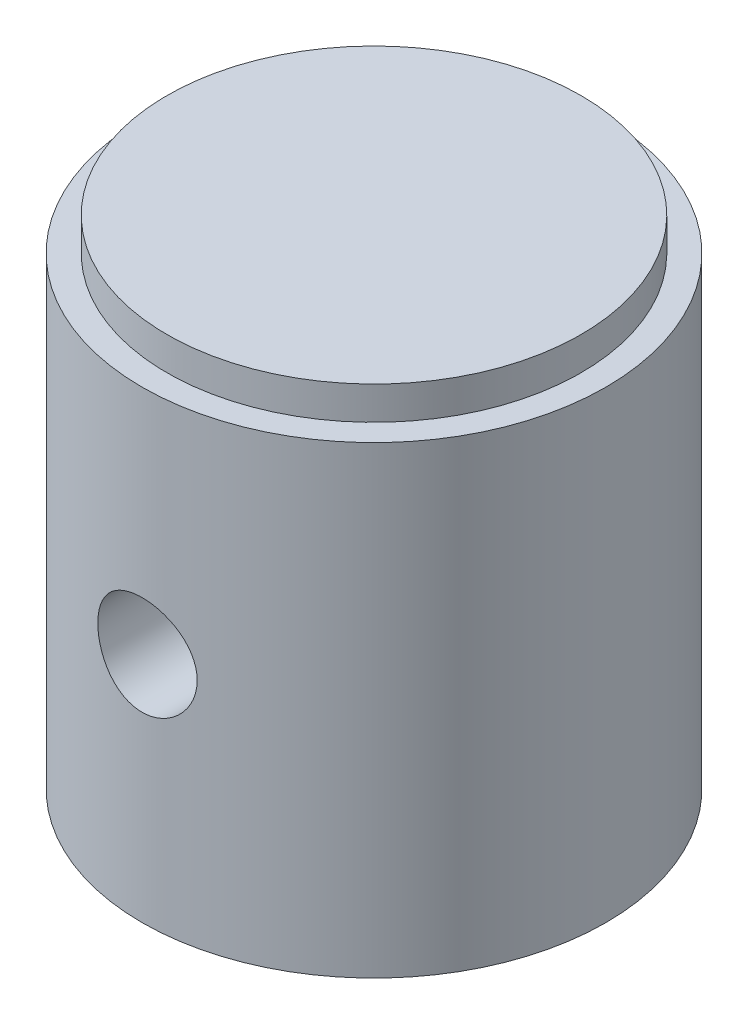
from build123d import *

# Parameters (mm, degrees)
CUT_EXTRUDE1_DEPTH      = 14.868123463
CUT_EXTRUDE1_DEPTH_BACK = 14.868123463
SKETCH2_R               = 1.5
SCALE1_SCALE            = 1.5


with BuildPart() as part:
    # Sketch1 → Revolve1 (revolve)
    with BuildSketch(Plane.XY, mode=Mode.PRIVATE) as revolve1_sk:
        Polygon((0, 9.712098042), (-6.25, 9.712098042), (-6.25, 8.712098042), (-7, 8.712098042), (-7, -5.287901958), (-6.25, -5.287901958), (-4.75, -1.166685828), (-4.75, 5.712098042), (0, 8.566185983), align=None)
    revolve(revolve1_sk.sketch.rotate(Axis((0, 2.420801252, 0), (0, 1, 0)), 270), axis=Axis((0, 2.420801252, 0), (0, 1, 0)))

    # Sketch2 → Cut-Extrude1 (cut, two sides: drawn at the far end of the back side and taken through both)
    with BuildSketch(Plane.XY.offset(-CUT_EXTRUDE1_DEPTH_BACK)):
        with Locations((0, 1.712098042)):
            Circle(SKETCH2_R)
    extrude(amount=CUT_EXTRUDE1_DEPTH + CUT_EXTRUDE1_DEPTH_BACK, mode=Mode.SUBTRACT)


with BuildPart() as part_1:
    # Scale1: scaled about (3.5175e-05, 3.523748347, -7.815e-06)
    add(part.part.scale(SCALE1_SCALE).moved(Location((-1.7588e-05, -1.761874174, 3.908e-06))))


solid = part_1.part
